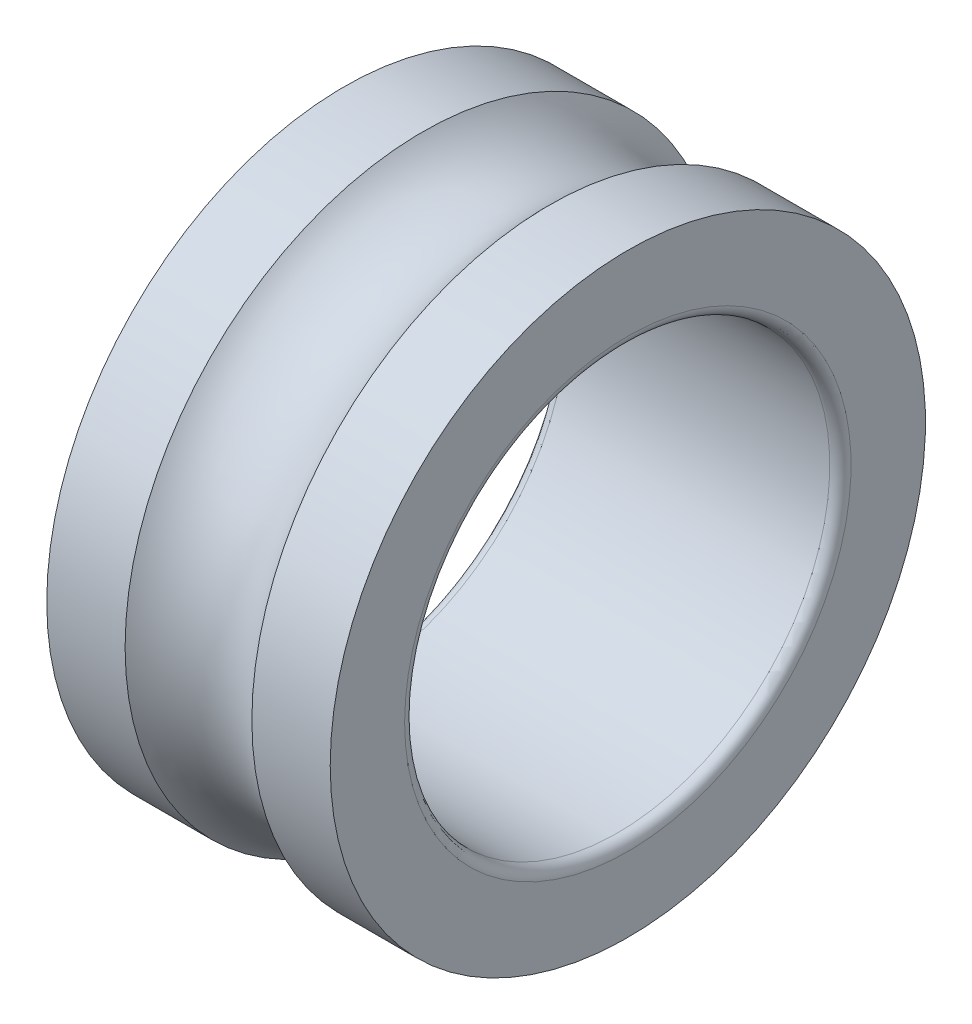
from build123d import *


with BuildPart() as part:
    # Esquisse1 → Base-Révolution (revolve)
    with BuildSketch(Plane(origin=(0, 0, 0), x_dir=(1, 0, 0), z_dir=(0, 1, 0))):
        with BuildLine():
            Line((0, 8.4), (0, 6.3))
            ThreePointArc((0, 6.3), (0.087867966, 6.087867966), (0.3, 6))
            Line((0.3, 6), (7.7, 6))
            ThreePointArc((7.7, 6), (7.912132034, 6.087867966), (8, 6.3))
            Line((8, 6.3), (8, 8.4))
            Line((8, 8.4), (5.788854382, 8.4))
            ThreePointArc((5.788854382, 8.4), (4, 7.6), (2.211145618, 8.4))
            Line((2.211145618, 8.4), (0, 8.4))
        make_face()
    revolve(axis=Axis((0, 0, 0), (1, 0, 0)))


solid = part.part
